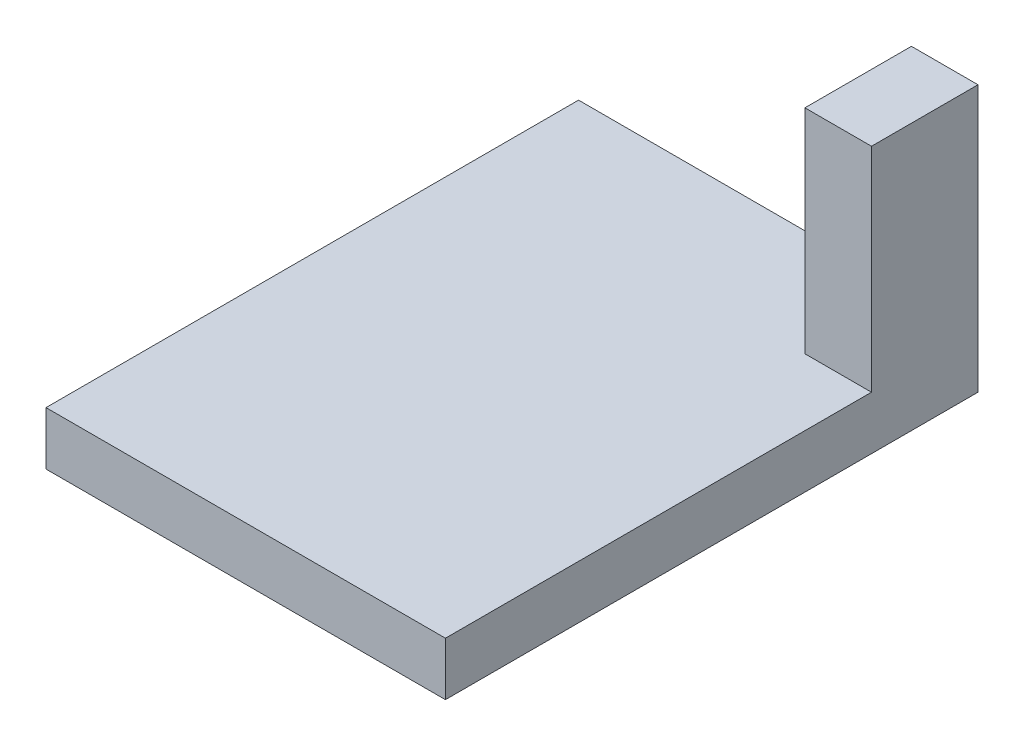
from build123d import *

# Parameters (mm, degrees)
SKETCH_1_W      = 2.5
SKETCH_1_H      = 4
EXTRUDE_1_DEPTH = 8
SKETCH_2_W      = 15
SKETCH_2_H      = 20
EXTRUDE_2_DEPTH = 2


with BuildPart() as part:
    # 草图1 → 凸台-拉伸1 (new body)
    with BuildSketch(Plane(origin=(0, 0, 0), x_dir=(1, 0, 0), z_dir=(0, 1, 0))):
        with Locations((1.25, 2)):
            Rectangle(SKETCH_1_W, SKETCH_1_H)
    extrude(amount=EXTRUDE_1_DEPTH)

    # 草图2 → 凸台-拉伸2 (add)
    with BuildSketch(Plane.XZ):
        with Locations((-5, 6)):
            Rectangle(SKETCH_2_W, SKETCH_2_H)
    extrude(amount=EXTRUDE_2_DEPTH)


solid = part.part
